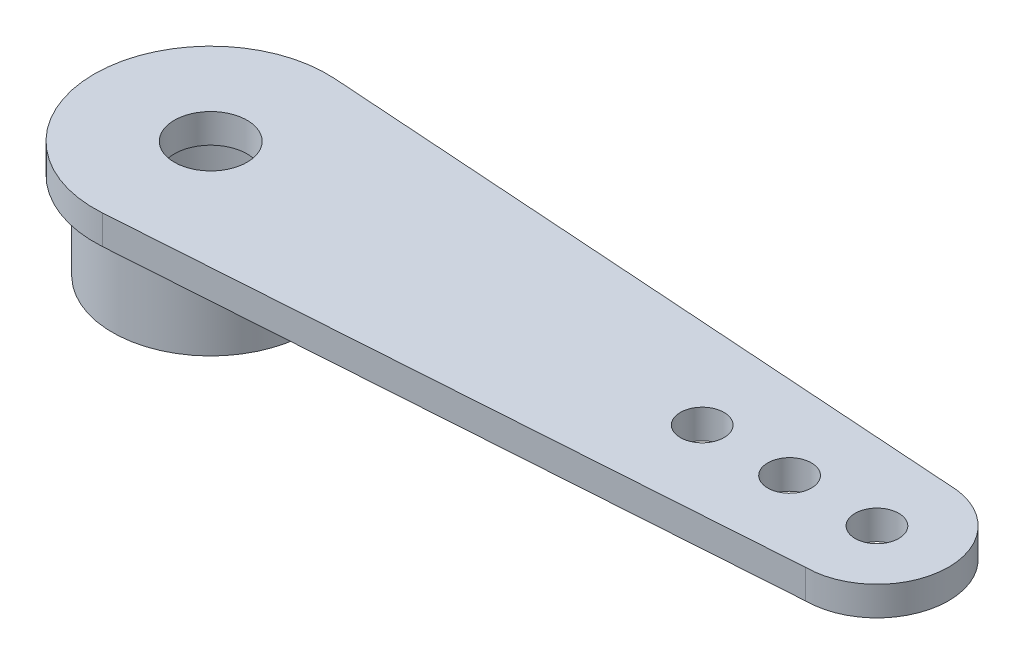
from build123d import *

# Parameters (mm, degrees)
SKETCH5_R           = 3.429
SKETCH5_R_2         = 2.794
BOSS_EXTRUDE3_DEPTH = 3.048
SKETCH6_R           = 0.762
SKETCH6_R_2         = 1.27
BOSS_EXTRUDE4_DEPTH = 1.016


with BuildPart() as part:
    # Sketch5 → Boss-Extrude3 (new body)
    with BuildSketch(Plane(origin=(0, 0, 0), x_dir=(1, 0, 0), z_dir=(0, 1, 0))):
        with Locations(Location((0, 0, 0), (0, 0, 90))):
            Circle(SKETCH5_R)
        with Locations(Location((0, 0, 0), (0, 0, 90))):
            Circle(SKETCH5_R_2, mode=Mode.SUBTRACT)
    extrude(amount=BOSS_EXTRUDE3_DEPTH)

    # Sketch6 → Boss-Extrude4 (add)
    with BuildSketch(Plane(origin=(0, 3.048, 0), x_dir=(1, 0, 0), z_dir=(0, 1, 0))):
        with BuildLine():
            ThreePointArc((0.275010076, 4.054684385), (-4.064, 0), (0.275010076, -4.054684385))
            Line((0.275010076, -4.054684385), (23.241, -2.497009847))
            ThreePointArc((23.241, -2.497009847), (25.738009847, 0), (23.241, 2.497009847))
            Line((23.241, 2.497009847), (0.275010076, 4.054684385))
        make_face()
        with Locations(Location((20.193, 0, 0), (0, 0, 270))):
            Circle(SKETCH6_R, mode=Mode.SUBTRACT)
        with Locations(Location((0, 0, 0), (0, 0, 270))):
            Circle(SKETCH6_R_2, mode=Mode.SUBTRACT)
        with Locations(Location((17.145, 0, 0), (0, 0, 270))):
            Circle(SKETCH6_R, mode=Mode.SUBTRACT)
        with Locations(Location((23.241, 0, 0), (0, 0, 270))):
            Circle(SKETCH6_R, mode=Mode.SUBTRACT)
    extrude(amount=BOSS_EXTRUDE4_DEPTH)


solid = part.part
